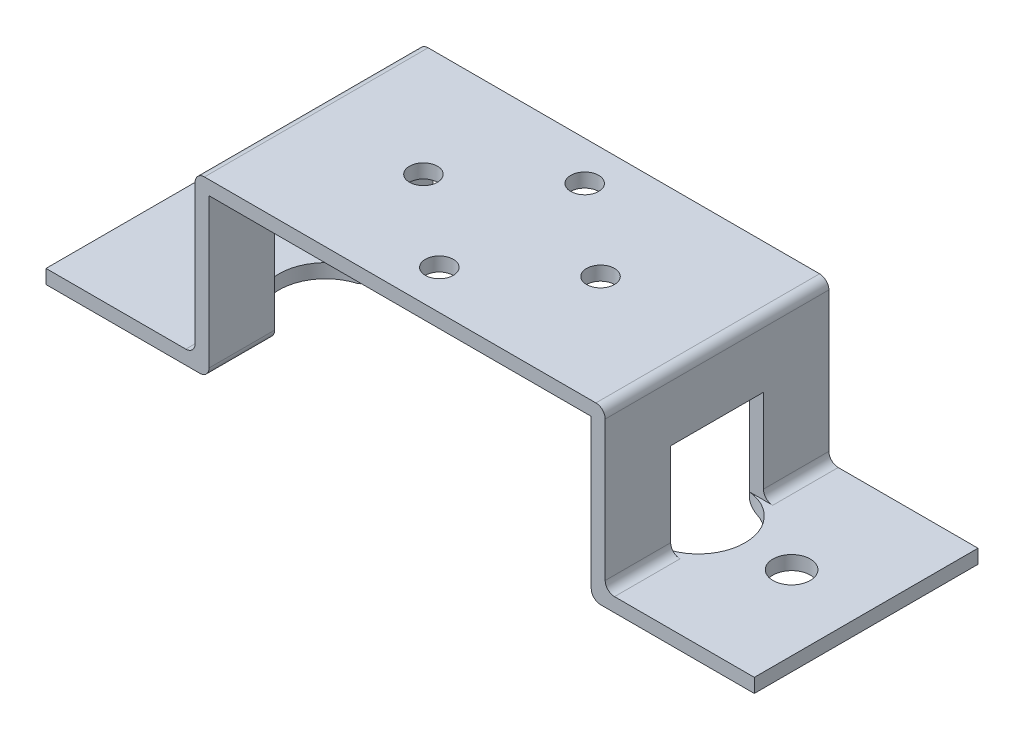
from build123d import *

# Parameters (mm, degrees)
BOSS_EXTRUDE2_DEPTH     = 24
CUT_EXTRUDE1_DEPTH      = 82.49233092751734
CUT_EXTRUDE1_DEPTH_BACK = 82.49233092751734
SKETCH17_R              = 1.9999999999999996
SKETCH17_R_2            = 1.9999999999999962
F_3_0MM_DOWEL_HOLE1_D   = 3
SKETCH22_R              = 5.000000000000001
SKETCH22_R_2            = 4.9999999999999964
CUT_EXTRUDE2_DEPTH      = 1.5
CUT_EXTRUDE3_DEPTH      = 68.21792915584354
CUT_EXTRUDE3_DEPTH_BACK = 68.21792915584354
SKETCH23_W              = 9.949874371066619
SKETCH23_H              = 10
FILLET1_R               = 1


with BuildPart() as part:
    # 3DSketch1 → Boss-Extrude2 (new body)
    with BuildSketch(Plane(origin=(0, 0, 0), x_dir=(0.9998052854172774, 0.01973299905428837, 0), z_dir=(-3e-17, -8.8e-16, 1))):
        Polygon((0, 0), (17.496592494802357, -0.34532748345004655), (17.832053478725257, 16.65136236864367), (58.82407018083363, 15.842309407417849), (58.48860919691073, -1.1543804446758696), (75.98520169171307, -1.499707928125916), (76.0148011902945, 2.2e-16), (60.01791662361808, 0.3157279848686118), (60.353377607540985, 17.312417836962325), (16.361945049180772, 18.180669795351015), (16.02648406525787, 1.1839799432573024), (0.02959949858143255, 1.4997079281259162), align=None)
    extrude(amount=BOSS_EXTRUDE2_DEPTH)

    # Sketch17 → Cut-Extrude1 (cut, two sides: drawn at the far end of the back side and taken through both)
    with BuildSketch(Plane(origin=(0, 1.5, 0), x_dir=(1, 0, 0), z_dir=(0, 1, 0)).offset(-CUT_EXTRUDE1_DEPTH_BACK)):
        with Locations(Location((8, -12.000000000000002, 0), (0, 0, 270))):
            Circle(SKETCH17_R)
        with Locations(Location((68, -12.000000000000002, 0), (0, 0, 270))):
            Circle(SKETCH17_R_2)
    extrude(amount=CUT_EXTRUDE1_DEPTH + CUT_EXTRUDE1_DEPTH_BACK, mode=Mode.SUBTRACT)

    # Ø3.0mm Dowel Hole1 (through all)
    with Locations(Plane(origin=(0, 18.5, 0), x_dir=(1, 0, 0), z_dir=(0, 1, 0))):
        with Locations((28.5, -12), (47.5, -12), (38, -19.8), (38, -4.2)):
            Hole(F_3_0MM_DOWEL_HOLE1_D / 2)

    # Sketch22 → Cut-Extrude2 (cut)
    with BuildSketch(Plane(origin=(0, 1.5, 0), x_dir=(1, 0, 0), z_dir=(0, 1, 0))):
        with Locations((17.999999999997943, -12.000000000000927)):
            Circle(SKETCH22_R)
        with Locations((58.00000000000207, -12.000000000000927)):
            Circle(SKETCH22_R_2)
    extrude(amount=-CUT_EXTRUDE2_DEPTH, mode=Mode.SUBTRACT)

    # Sketch23 → Cut-Extrude3 (cut, two sides: drawn at the far end of the back side and taken through both)
    with BuildSketch(Plane.ZY.offset(-16).offset(-CUT_EXTRUDE3_DEPTH_BACK)):
        with Locations((12.000000000000927, 6.5)):
            Rectangle(SKETCH23_W, SKETCH23_H)
    extrude(amount=CUT_EXTRUDE3_DEPTH + CUT_EXTRUDE3_DEPTH_BACK, mode=Mode.SUBTRACT)

    # Fillet1
    fillet1_edges = [part.edges().sort_by_distance(p)[0] for p in [
        (17.500000000000004, -3.09e-15, 3.5125314072338187),
        (17.500000000000004, -1.8e-14, 20.487468592767108),
        (58.50000000000001, -3.09e-15, 3.5125314072338214),
        (58.50000000000001, -1.8e-14, 20.487468592767108),
        (15.999999999999998, 18.49999999999999, 12.000000000000016),
        (60.000000000000014, 18.49999999999999, 12.000000000000018),
        (60.00000000000001, 1.49999999999998, 20.48746859276712),
        (60.00000000000001, 1.499999999999995, 3.512531407233811),
        (15.999999999999998, 1.4999999999999825, 20.48746859276712),
        (15.999999999999998, 1.4999999999999973, 3.5125314072338103),
    ]]
    fillet(fillet1_edges, radius=FILLET1_R)


solid = part.part
